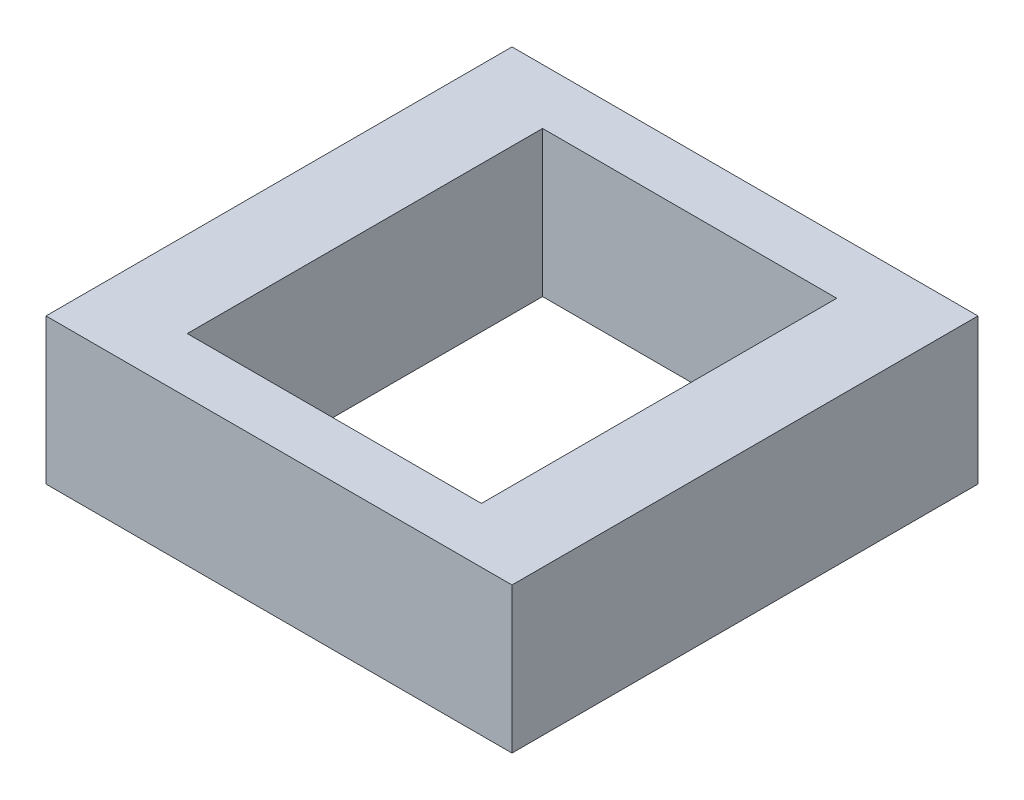
from build123d import *

# Parameters (mm, degrees)
SKETCH1_W           = 16
SKETCH1_H           = 16
SKETCH1_W_2         = 10.1
SKETCH1_H_2         = 12.2
BOSS_EXTRUDE1_DEPTH = 5


with BuildPart() as part:
    # Sketch1 → Boss-Extrude1 (new body)
    with BuildSketch(Plane(origin=(0, 0, 0), x_dir=(1, 0, 0), z_dir=(0, 1, 0))):
        Rectangle(SKETCH1_W, SKETCH1_H)
        Rectangle(SKETCH1_W_2, SKETCH1_H_2, mode=Mode.SUBTRACT)
    extrude(amount=BOSS_EXTRUDE1_DEPTH)


solid = part.part
